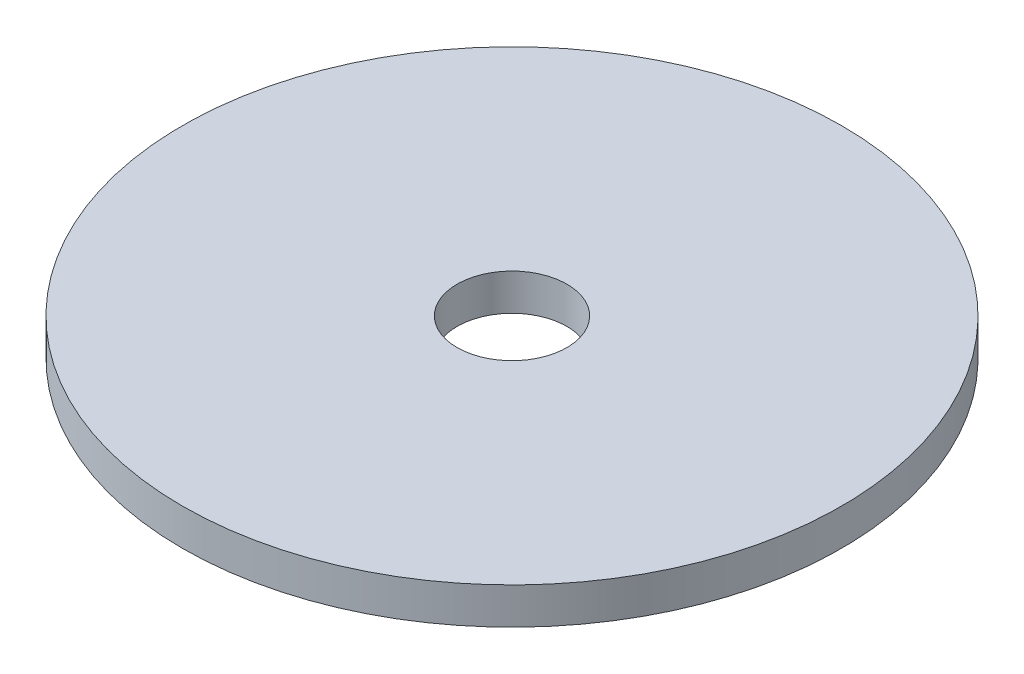
from build123d import *

# Parameters (mm, degrees)
SKETCH_1_R      = 36
SKETCH_1_R_2    = 6
EXTRUDE_1_DEPTH = 4


with BuildPart() as part:
    # Эскиз1 → Вытянуть1 (new body)
    with BuildSketch(Plane(origin=(0, 0, 0), x_dir=(1, 0, 0), z_dir=(0, 1, 0))):
        with Locations(Location((0, 0, 0), (0, 0, 270))):
            Circle(SKETCH_1_R)
        with Locations(Location((0, 0, 0), (0, 0, 270))):
            Circle(SKETCH_1_R_2, mode=Mode.SUBTRACT)
    extrude(amount=EXTRUDE_1_DEPTH)


solid = part.part
